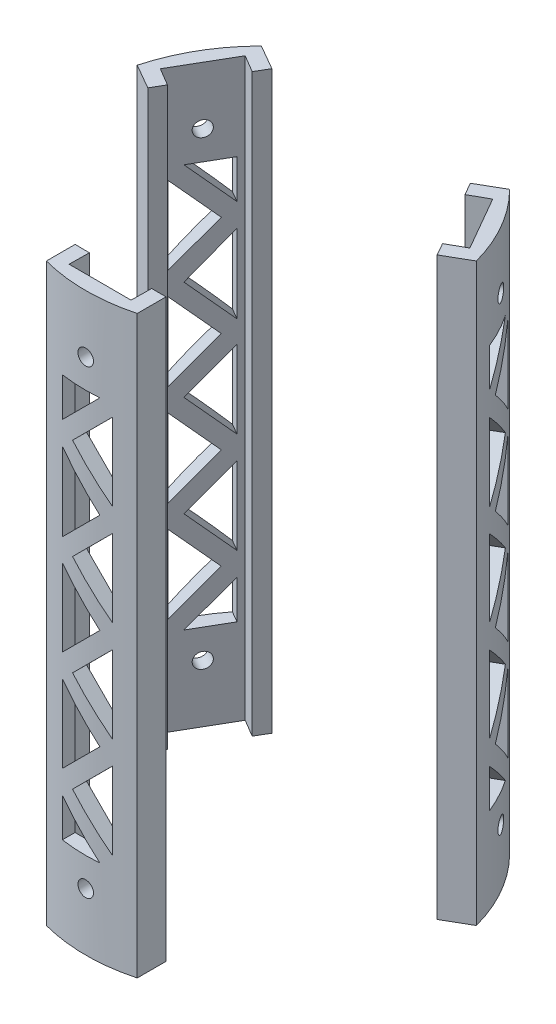
from build123d import *

# Parameters (mm, degrees)
BOSS_EXTRUDE1_DEPTH = 100
SKETCH2_R           = 1.35
CUT_EXTRUDE1_DEPTH  = 100
CUT_EXTRUDE5_DEPTH  = 100
CIRPATTERN3_COUNT   = 3


with BuildPart() as part:
    # Sketch1 → Boss-Extrude1 (new body)
    with BuildSketch(Plane(origin=(0, 0, 0), x_dir=(1, 0, 0), z_dir=(0, 1, 0))):
        with BuildLine():
            ThreePointArc((-7.893980876, -29.460737702), (0, -30.5), (7.893980876, -29.460737702))
            Line((7.893980876, -29.460737702), (7.893980876, -24.460737702))
            Line((7.893980876, -24.460737702), (5.393980876, -24.460737702))
            Line((5.393980876, -24.460737702), (5.351792798, -27.993004731))
            Line((5.351792798, -27.993004731), (-5.438609433, -27.976267218))
            Line((-5.438609433, -27.976267218), (-5.394184134, -24.49261639))
            Line((-5.394184134, -24.49261639), (-7.893980876, -24.460737702))
            Line((-7.893980876, -24.460737702), (-7.893980876, -29.460737702))
        make_face()
    extrude(amount=BOSS_EXTRUDE1_DEPTH)

    # Sketch2 → Cut-Extrude1 (cut)
    with BuildSketch(Plane(origin=(-0.043408318, 0, 27.984635974), x_dir=(-0.9999987969718115, 0, -0.0015511463276222017), z_dir=(0.001551146327622202, 0, -0.9999987969718116))):
        with Locations((0, 90)):
            Circle(SKETCH2_R)
        with Locations((0, 10)):
            Circle(SKETCH2_R)
    extrude(amount=-CUT_EXTRUDE1_DEPTH, mode=Mode.SUBTRACT)

    # Sketch3 → Cut-Extrude5 (cut)
    with BuildSketch(Plane(origin=(-0.043408318, 0, 27.984635974), x_dir=(-0.9999987969718115, 0, -0.0015511463276222017), z_dir=(0.001551146327622202, 0, -0.9999987969718116))):
        Polygon((4.356186013, 85), (-2.395207606, 85), (4.356186013, 78.248606382), align=None)
        Polygon((2.356186013, 76.248606382), (-4.395207606, 83), (-4.395207606, 69.497212763), align=None)
        Polygon((4.356186013, 60.596414532), (4.356186013, 74.248606382), (-2.395207606, 67.347808151), align=None)
        Polygon((2.356186013, 58.745819145), (-4.395207606, 65.497212763), (-4.395207606, 51.994425526), align=None)
        Polygon((4.356186013, 43.248606382), (4.356186013, 56.745819145), (-2.395207606, 50), align=None)
        Polygon((2.356186013, 41.243028354), (-4.395207606, 48), (-4.395207606, 34.491634736), align=None)
        Polygon((4.356186013, 25.745815591), (4.356186013, 39.243028354), (-2.395207606, 32.49720921), align=None)
        Polygon((2.356186013, 23.740237564), (-4.395207606, 30.49720921), (-4.395207606, 16.988843946), align=None)
        Polygon((4.356186013, 15), (4.356186013, 21.740237564), (-2.395207606, 15), align=None)
    extrude(amount=-CUT_EXTRUDE5_DEPTH, mode=Mode.SUBTRACT)


with BuildPart() as cirpattern3_1:
    # CirPattern3: pattern copy
    add(part.part.rotate(Axis((0, -5, 0), (0, 1, 0)), 1 * 360 / CIRPATTERN3_COUNT))


with BuildPart() as cirpattern3_2:
    # CirPattern3: pattern copy
    add(part.part.rotate(Axis((0, -5, 0), (0, 1, 0)), 2 * 360 / CIRPATTERN3_COUNT))


solid = Compound([part.part, cirpattern3_1.part, cirpattern3_2.part])
